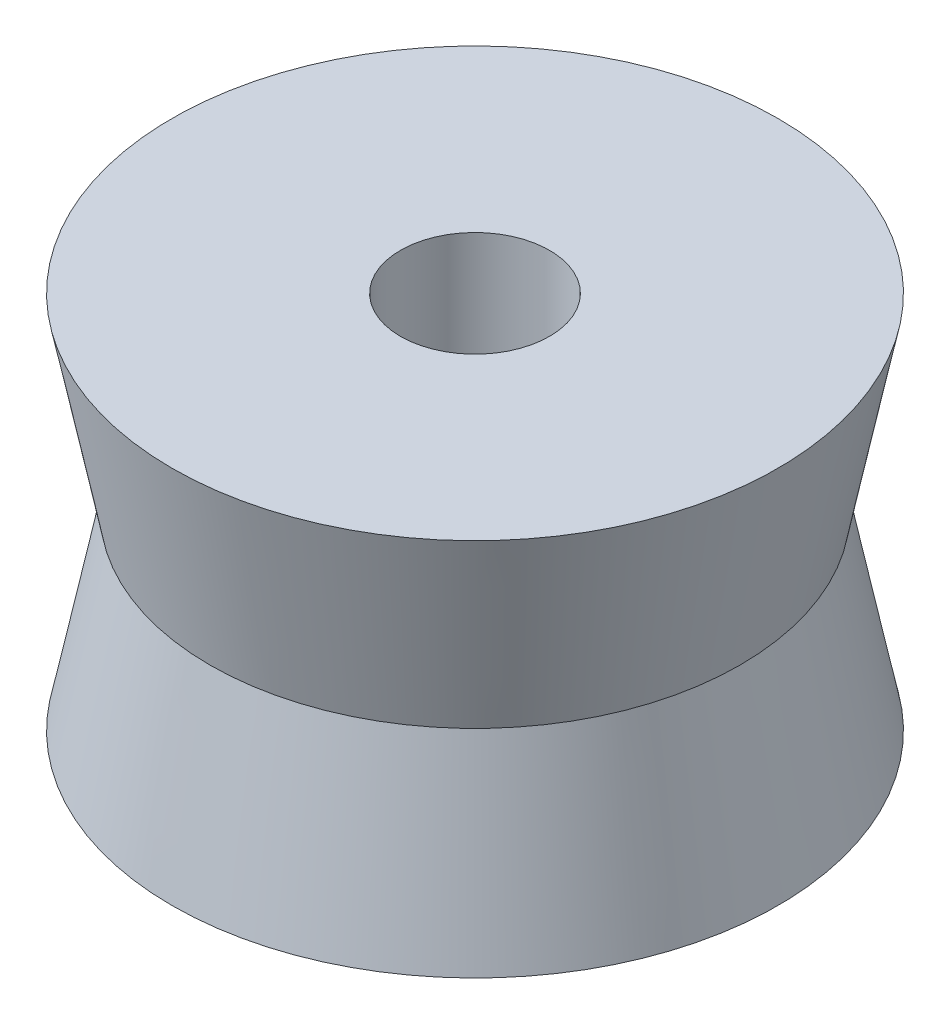
from build123d import *

# Parameters (mm, degrees)
SKETCH1_W = 1.31
SKETCH1_H = 12.7


with BuildPart() as part:
    # Sketch1 → Revolve1 (revolve)
    with BuildSketch(Plane(origin=(0, 0, 0), x_dir=(0, 0, -1), z_dir=(1, 0, 0))):
        Polygon((-10.16, 0), (-3.81, 0), (-3.81, 12.7), (-10.16, 12.7), (-8.89, 6.35), align=None)
        Polygon((-10.16, 0), (-3.81, 0), (-3.81, 12.7), (-10.16, 12.7), (-8.89, 6.35), align=None)
        Polygon((-10.16, 0), (-3.81, 0), (-3.81, 12.7), (-10.16, 12.7), (-8.89, 6.35), align=None)
        with Locations((-3.155, 6.35)):
            Rectangle(SKETCH1_W, SKETCH1_H)
    revolve(axis=Axis((0, 12.7, 0), (0, -1, 0)))


solid = part.part
